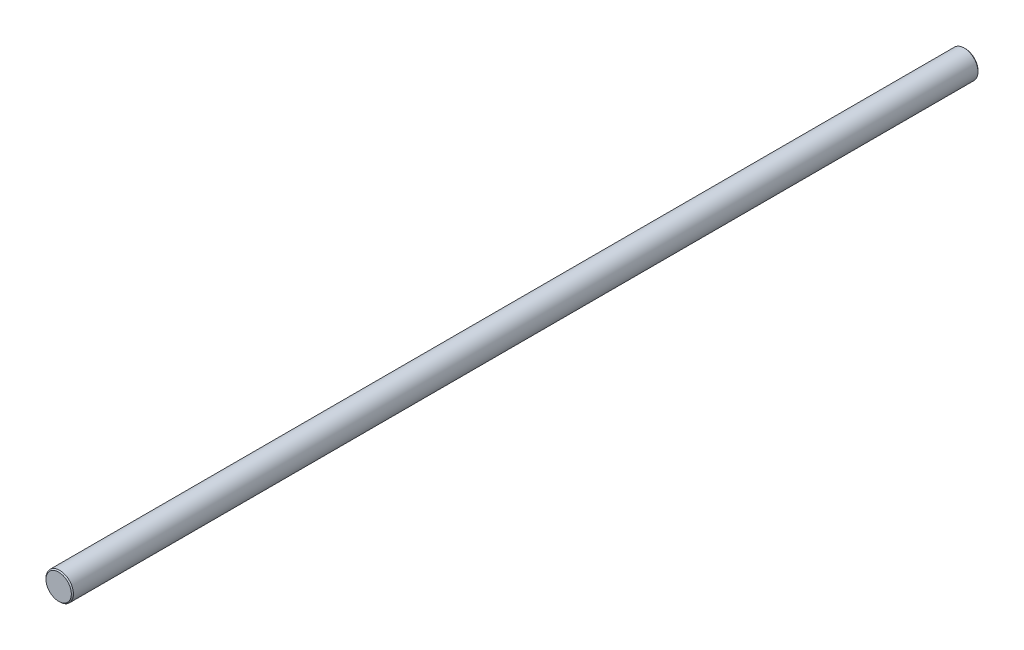
from build123d import *

# Parameters (mm, degrees)
SKETCH1_R           = 10
BOSS_EXTRUDE1_DEPTH = 330.2
CHAMFER1_SIZE       = 0.762


with BuildPart() as part:
    # Sketch1 → Boss-Extrude1 (new, symmetric)
    with BuildSketch(Plane.XY):
        Circle(SKETCH1_R)
    extrude(amount=BOSS_EXTRUDE1_DEPTH, both=True)

    # Chamfer1
    chamfer1_edges = [part.edges().sort_by_distance(p)[0] for p in [
        (-10, 0, -330.2),
        (-10, 0, 330.2),
    ]]
    chamfer(chamfer1_edges, length=CHAMFER1_SIZE)


solid = part.part
